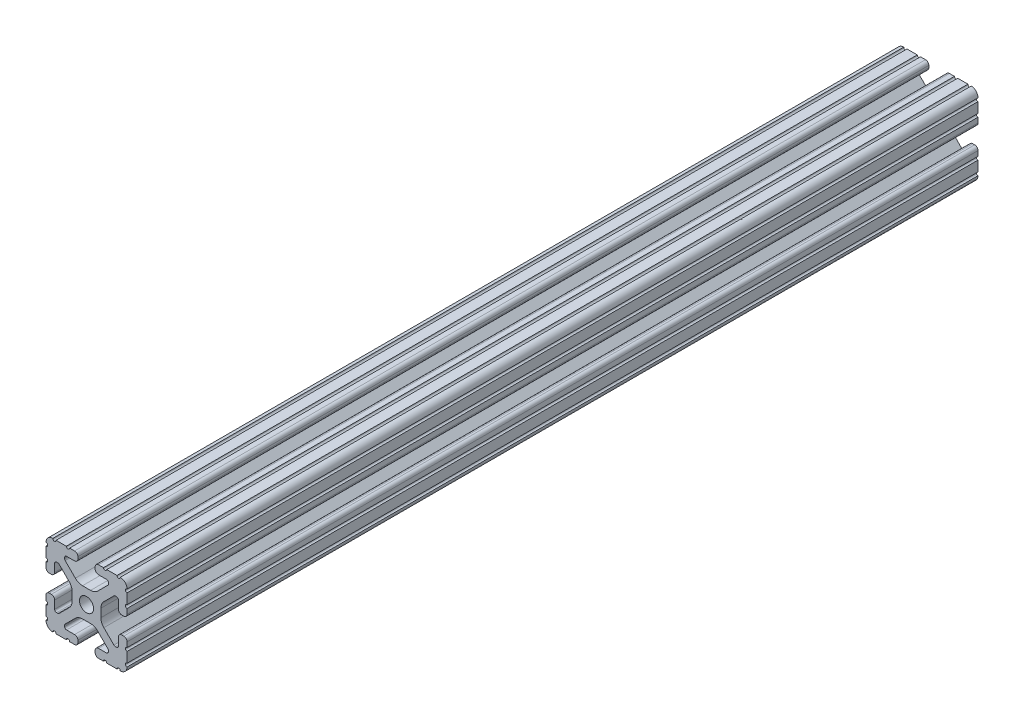
from build123d import *

# Parameters (mm, degrees)
SKETCH1_R = 3.3274


with BuildPart() as part:
    # Sweep1: sweep along a path in Sketch2
    with BuildLine(Plane(origin=(0, 0, 0), x_dir=(1, 0, 0), z_dir=(0, 1, 0))) as sweep1_path:
        Line((0, 304.8), (0, -95.2))
    # Sketch1 → Sweep1 (sweep)
    with BuildSketch(Plane(origin=(0, 0, -304.8), x_dir=(-1, 0, 0), z_dir=(0, 0, -1))):
        with BuildLine():
            Line((14.327719201, 19.050000003), (9.498178698, 19.050000003))
            ThreePointArc((9.498178698, 19.050000003), (8.736178698, 18.288000003), (7.974178698, 19.050000003))
            Line((7.974178698, 19.050000003), (5.61761756, 19.050000003))
            ThreePointArc((5.61761756, 19.050000003), (4.519044055, 18.594955959), (4.06400001, 17.496382454))
            Line((4.06400001, 17.496382454), (4.06400001, 16.539617563))
            ThreePointArc((4.06400001, 16.539617563), (4.519044055, 15.441044058), (5.61761756, 14.986000013))
            Line((5.61761756, 14.986000013), (9.38530001, 14.986000013))
            ThreePointArc((9.38530001, 14.986000013), (10.022898195, 14.721898198), (10.28700001, 14.084300013))
            Line((10.28700001, 14.084300013), (10.28700001, 13.552357144))
            ThreePointArc((10.28700001, 13.552357144), (10.218362397, 13.207292006), (10.022898979, 12.914759744))
            Line((10.022898979, 12.914759744), (5.252158118, 8.144007146))
            ThreePointArc((5.252158118, 8.144007146), (3.715177385, 7.117027402), (1.902183988, 6.756400013))
            Line((1.902183988, 6.756400013), (-1.902183965, 6.756400013))
            ThreePointArc((-1.902183965, 6.756400013), (-3.715177361, 7.117027401), (-5.252158094, 8.144007145))
            Line((-5.252158094, 8.144007145), (-10.022898959, 12.914759744))
            ThreePointArc((-10.022898959, 12.914759744), (-10.218362376, 13.207292006), (-10.28699999, 13.552357144))
            Line((-10.28699999, 13.552357144), (-10.28699999, 14.084300013))
            ThreePointArc((-10.28699999, 14.084300013), (-10.022898174, 14.721898198), (-9.38529999, 14.986000013))
            Line((-9.38529999, 14.986000013), (-5.617617539, 14.986000013))
            ThreePointArc((-5.617617539, 14.986000013), (-4.519044035, 15.441044058), (-4.06399999, 16.539617563))
            Line((-4.06399999, 16.539617563), (-4.06399999, 17.496382454))
            ThreePointArc((-4.06399999, 17.496382454), (-4.519044035, 18.594955959), (-5.617617539, 19.050000003))
            Line((-5.617617539, 19.050000003), (-7.974178709, 19.050000003))
            ThreePointArc((-7.974178709, 19.050000003), (-8.736178709, 18.288000003), (-9.498178709, 19.050000003))
            Line((-9.498178709, 19.050000003), (-14.327719212, 19.050000003))
            ThreePointArc((-14.327719212, 19.050000003), (-15.087603125, 18.231251135), (-15.847487045, 19.049999996))
            ThreePointArc((-15.847487045, 19.049999996), (-18.120176306, 18.120192065), (-19.050000001, 15.847509253))
            ThreePointArc((-19.050000001, 15.847509253), (-18.231251012, 15.087625373), (-19.049999993, 14.327741484))
            Line((-19.049999993, 14.327741484), (-19.049999993, 9.49609147))
            ThreePointArc((-19.049999993, 9.49609147), (-18.231250986, 8.736207564), (-19.049999993, 7.976323658))
            Line((-19.049999993, 7.976323658), (-19.049999993, 5.617617549))
            ThreePointArc((-19.049999993, 5.617617549), (-18.594955948, 4.519044045), (-17.496382444, 4.064))
            Line((-17.496382444, 4.064), (-16.539617542, 4.064))
            ThreePointArc((-16.539617542, 4.064), (-15.441044038, 4.519044045), (-14.985999993, 5.617617549))
            Line((-14.985999993, 5.617617549), (-14.985999993, 9.385342517))
            ThreePointArc((-14.985999993, 9.385342517), (-14.721898178, 10.022940702), (-14.084299993, 10.287042517))
            Line((-14.084299993, 10.287042517), (-13.516042079, 10.287042517))
            ThreePointArc((-13.516042079, 10.287042517), (-13.170975915, 10.218404479), (-12.87844311, 10.022939917))
            Line((-12.87844311, 10.022939917), (-8.147580073, 5.292065242))
            ThreePointArc((-8.147580073, 5.292065242), (-7.117955872, 3.751120652), (-6.756399993, 1.933453584))
            Line((-6.756399993, 1.933453584), (-6.756399993, -1.933453584))
            ThreePointArc((-6.756399993, -1.933453584), (-7.117955872, -3.751120652), (-8.147580073, -5.292065242))
            Line((-8.147580073, -5.292065242), (-12.87844311, -10.022939917))
            ThreePointArc((-12.87844311, -10.022939917), (-13.170975915, -10.218404479), (-13.516042079, -10.287042517))
            Line((-13.516042079, -10.287042517), (-14.084299993, -10.287042517))
            ThreePointArc((-14.084299993, -10.287042517), (-14.721898178, -10.022940702), (-14.985999993, -9.385342517))
            Line((-14.985999993, -9.385342517), (-14.985999993, -5.617617549))
            ThreePointArc((-14.985999993, -5.617617549), (-15.441044038, -4.519044045), (-16.539617542, -4.064))
            Line((-16.539617542, -4.064), (-17.496382444, -4.064))
            ThreePointArc((-17.496382444, -4.064), (-18.594955948, -4.519044045), (-19.049999993, -5.617617549))
            Line((-19.049999993, -5.617617549), (-19.049999993, -7.97631849))
            ThreePointArc((-19.049999993, -7.97631849), (-18.231250986, -8.736202396), (-19.049999993, -9.496086301))
            Line((-19.049999993, -9.496086301), (-19.049999993, -14.327742909))
            ThreePointArc((-19.049999993, -14.327742909), (-18.231250983, -15.08762681), (-19.049999984, -15.847510721))
            ThreePointArc((-19.049999984, -15.847510721), (-18.120175688, -18.120192657), (-15.847486815, -19.049999997))
            ThreePointArc((-15.847486815, -19.049999997), (-15.087602925, -18.231251148), (-14.327719025, -19.049999987))
            Line((-14.327719025, -19.049999987), (-9.496062438, -19.049999987))
            ThreePointArc((-9.496062438, -19.049999987), (-8.736178522, -18.231251122), (-7.976294605, -19.049999987))
            Line((-7.976294605, -19.049999987), (-5.617617539, -19.049999987))
            ThreePointArc((-5.617617539, -19.049999987), (-4.519044035, -18.594955942), (-4.06399999, -17.496382437))
            Line((-4.06399999, -17.496382437), (-4.06399999, -16.539617536))
            ThreePointArc((-4.06399999, -16.539617536), (-4.519044035, -15.441044031), (-5.617617539, -14.985999987))
            Line((-5.617617539, -14.985999987), (-9.38529999, -14.985999987))
            ThreePointArc((-9.38529999, -14.985999987), (-10.022898174, -14.721898171), (-10.28699999, -14.084299987))
            Line((-10.28699999, -14.084299987), (-10.28699999, -13.552357118))
            ThreePointArc((-10.28699999, -13.552357118), (-10.218362376, -13.207291979), (-10.022898959, -12.914759717))
            Line((-10.022898959, -12.914759717), (-5.252158094, -8.144007118))
            ThreePointArc((-5.252158094, -8.144007118), (-3.715177361, -7.117027375), (-1.902183965, -6.756399987))
            Line((-1.902183965, -6.756399987), (1.902183988, -6.756399987))
            ThreePointArc((1.902183988, -6.756399987), (3.715177385, -7.117027375), (5.252158118, -8.144007119))
            Line((5.252158118, -8.144007119), (10.022898979, -12.914759717))
            ThreePointArc((10.022898979, -12.914759717), (10.218362397, -13.207291979), (10.28700001, -13.552357118))
            Line((10.28700001, -13.552357118), (10.28700001, -14.084299987))
            ThreePointArc((10.28700001, -14.084299987), (10.022898195, -14.721898171), (9.38530001, -14.985999987))
            Line((9.38530001, -14.985999987), (5.61761756, -14.985999987))
            ThreePointArc((5.61761756, -14.985999987), (4.519044055, -15.441044031), (4.06400001, -16.539617536))
            Line((4.06400001, -16.539617536), (4.06400001, -17.496382437))
            ThreePointArc((4.06400001, -17.496382437), (4.519044055, -18.594955942), (5.61761756, -19.049999987))
            Line((5.61761756, -19.049999987), (7.976294626, -19.049999987))
            ThreePointArc((7.976294626, -19.049999987), (8.736178543, -18.231251122), (9.496062459, -19.049999987))
            Line((9.496062459, -19.049999987), (14.327719046, -19.049999987))
            ThreePointArc((14.327719046, -19.049999987), (15.087602959, -18.231251119), (15.847486878, -19.04999998))
            ThreePointArc((15.847486878, -19.04999998), (18.12017574, -18.120192611), (19.050000007, -15.847510662))
            ThreePointArc((19.050000007, -15.847510662), (18.231250911, -15.087626785), (19.050000007, -14.327742909))
            Line((19.050000007, -14.327742909), (19.050000007, -9.496086301))
            ThreePointArc((19.050000007, -9.496086301), (18.231251003, -8.736202395), (19.050000007, -7.976318489))
            Line((19.050000007, -7.976318489), (19.050000007, -5.617617549))
            ThreePointArc((19.050000007, -5.617617549), (18.594955962, -4.519044045), (17.496382458, -4.064))
            Line((17.496382458, -4.064), (16.539617556, -4.064))
            ThreePointArc((16.539617556, -4.064), (15.441044052, -4.519044045), (14.986000007, -5.617617549))
            Line((14.986000007, -5.617617549), (14.986000007, -9.385342517))
            ThreePointArc((14.986000007, -9.385342517), (14.721898191, -10.022940702), (14.084300007, -10.287042517))
            Line((14.084300007, -10.287042517), (13.516042095, -10.287042517))
            ThreePointArc((13.516042095, -10.287042517), (13.170975932, -10.218404479), (12.878443126, -10.022939918))
            Line((12.878443126, -10.022939918), (8.147580087, -5.292065243))
            ThreePointArc((8.147580087, -5.292065243), (7.117955886, -3.751120653), (6.756400007, -1.933453584))
            Line((6.756400007, -1.933453584), (6.756400007, 1.933453584))
            ThreePointArc((6.756400007, 1.933453584), (7.117955886, 3.751120653), (8.147580087, 5.292065243))
            Line((8.147580087, 5.292065243), (12.878443126, 10.022939918))
            ThreePointArc((12.878443126, 10.022939918), (13.170975932, 10.218404479), (13.516042095, 10.287042517))
            Line((13.516042095, 10.287042517), (14.084300007, 10.287042517))
            ThreePointArc((14.084300007, 10.287042517), (14.721898191, 10.022940702), (14.986000007, 9.385342517))
            Line((14.986000007, 9.385342517), (14.986000007, 5.617617549))
            ThreePointArc((14.986000007, 5.617617549), (15.441044052, 4.519044045), (16.539617556, 4.064))
            Line((16.539617556, 4.064), (17.496382458, 4.064))
            ThreePointArc((17.496382458, 4.064), (18.594955962, 4.519044045), (19.050000007, 5.617617549))
            Line((19.050000007, 5.617617549), (19.050000007, 7.976323659))
            ThreePointArc((19.050000007, 7.976323659), (18.231251003, 8.736207565), (19.050000007, 9.496091471))
            Line((19.050000007, 9.496091471), (19.050000007, 14.327741484))
            ThreePointArc((19.050000007, 14.327741484), (18.231251061, 15.087625385), (19.049999988, 15.847509306))
            ThreePointArc((19.049999988, 15.847509306), (18.120176278, 18.120192088), (15.847487034, 19.050000003))
            ThreePointArc((15.847487034, 19.050000003), (15.087603117, 18.231251142), (14.327719201, 19.050000003))
        make_face()
        Circle(SKETCH1_R, mode=Mode.SUBTRACT)
    sweep(path=sweep1_path.line)


solid = part.part
